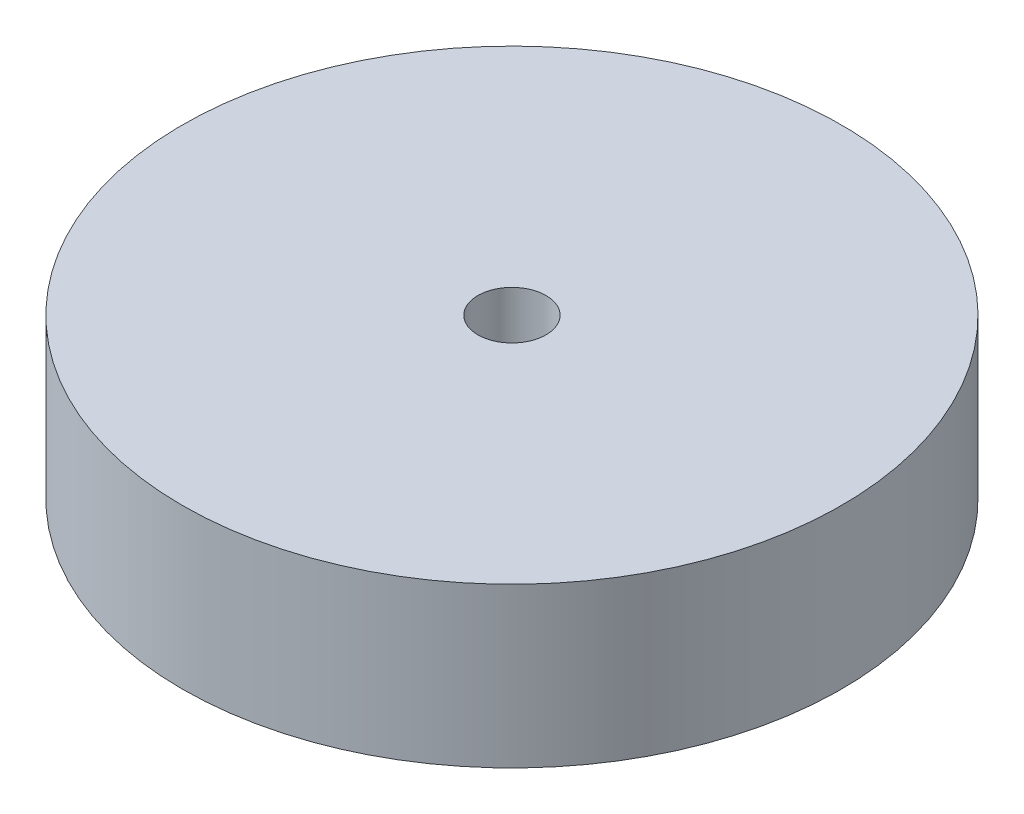
from build123d import *

# Parameters (mm, degrees)
SKETCH1_R      = 29
SKETCH1_R_2    = 3
EXTRUDE1_DEPTH = 14


with BuildPart() as part:
    # Sketch1 → Extrude1 (new body)
    with BuildSketch(Plane(origin=(0, 0, 0), x_dir=(1, 0, 0), z_dir=(0, 1, 0))):
        with Locations(Location((0, 0, 0), (0, 0, 270))):
            Circle(SKETCH1_R)
        with Locations(Location((0, 0, 0), (0, 0, 270))):
            Circle(SKETCH1_R_2, mode=Mode.SUBTRACT)
    extrude(amount=EXTRUDE1_DEPTH)


solid = part.part
